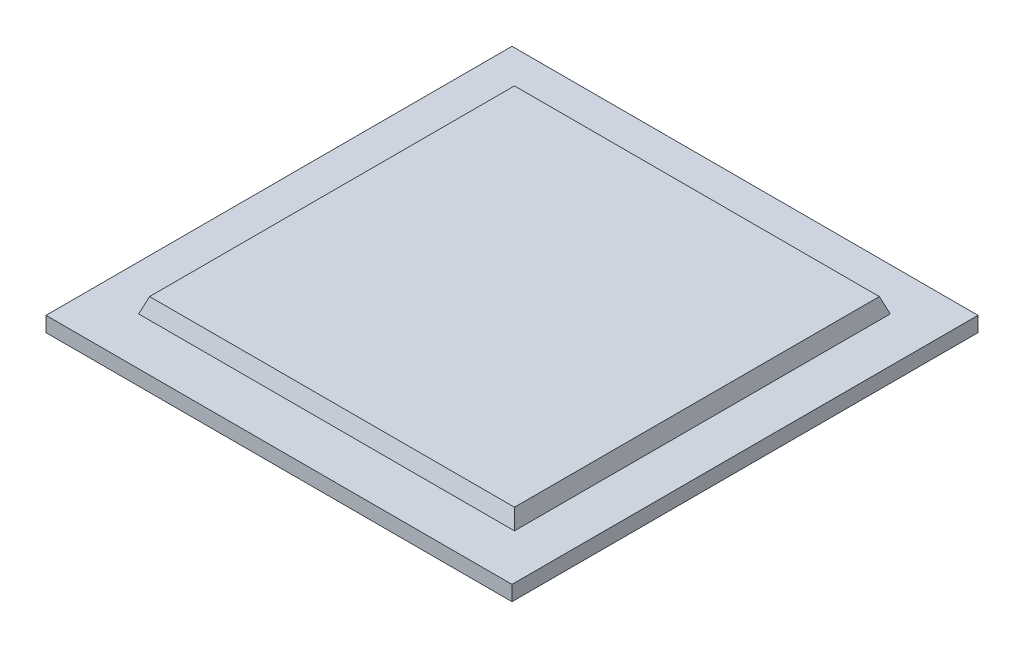
from build123d import *

# Parameters (mm, degrees)
SKETCH8_W            = 31
SKETCH8_H            = 31
BOSS_EXTRUDE4_DEPTH  = 1
SKETCH16_W           = 25
SKETCH16_H           = 25
BOSS_EXTRUDE11_DEPTH = 1
BOSS_EXTRUDE11_TAPER = 20


with BuildPart() as part:
    # Sketch8 → Boss-Extrude4 (new body)
    with BuildSketch(Plane(origin=(0, 0, 0), x_dir=(1, 0, 0), z_dir=(0, 1, 0))):
        Rectangle(SKETCH8_W, SKETCH8_H)
    extrude(amount=BOSS_EXTRUDE4_DEPTH)

    # Sketch16 → Boss-Extrude11 (add)
    with BuildSketch(Plane(origin=(0, 1, 0), x_dir=(1, 0, 0), z_dir=(0, 1, 0))):
        with Locations((0, 0.163009042)):
            Rectangle(SKETCH16_W, SKETCH16_H)
    extrude(amount=BOSS_EXTRUDE11_DEPTH, taper=BOSS_EXTRUDE11_TAPER)


solid = part.part
